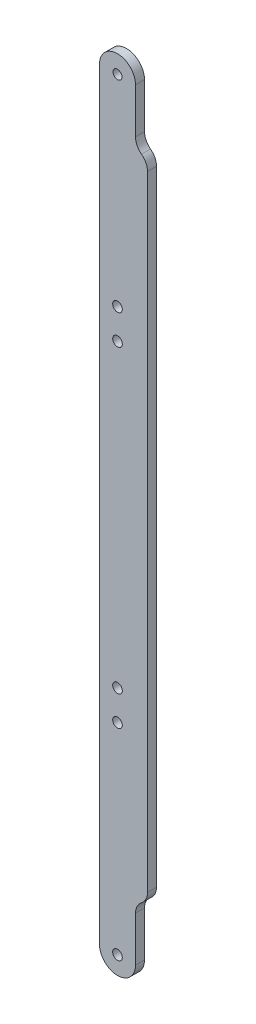
from build123d import *

# Parameters (mm, degrees)
SKETCH_2_W               = 18
SKETCH_2_H               = 90
SKETCH_2_R               = 1.6
EXTRUDE_1_DEPTH          = 3
SKETCH_3_R               = 1.5
SKETCH_3_W               = 18
SKETCH_3_H               = 45
EXTRUDE_2_DEPTH          = 3
SKETCH_4_R               = 1.6
CUT_EXTRUDE_1_DEPTH      = 3
CUT_EXTRUDE_2_DEPTH      = 139.102072216
CUT_EXTRUDE_2_DEPTH_BACK = 3


with BuildPart() as part:
    # 草图2 → 凸台-拉伸1 (new body)
    with BuildSketch(Plane.XY):
        with Locations((-9, -88.108866795)):
            Rectangle(SKETCH_2_W, SKETCH_2_H)
        with Locations((-10, -125.108866795)):
            Circle(SKETCH_2_R, mode=Mode.SUBTRACT)
    extrude(amount=EXTRUDE_1_DEPTH)

    # 草图3 → 凸台-拉伸2 (add)
    # profile 1 of 2: a face of its own
    with BuildSketch(Plane.XY.offset(3)):
        Polygon((-18, 1.891133205), (0, 1.891133205), (0, 46.891133205), (0, 136.891133205), (-18, 136.891133205), (-18, 46.891133205), align=None)
        with Locations((-10, 128.891133205)):
            Circle(SKETCH_3_R, mode=Mode.SUBTRACT)
    # profile 2 of 2: a face of its own
    with BuildSketch(Plane.XY.offset(3)):
        with Locations((-9, -20.608866795)):
            Rectangle(SKETCH_3_W, SKETCH_3_H)
    extrude(amount=-EXTRUDE_2_DEPTH)

    # 草图4 → 切除-拉伸1 (cut)
    with BuildSketch(Plane.XY.offset(3)):
        with Locations((-10, -58.108866795)):
            Circle(SKETCH_4_R)
        with Locations((-10, -48.108866795)):
            Circle(SKETCH_4_R)
        with Locations((-10, 51.891133205)):
            Circle(SKETCH_4_R)
        with Locations((-10, 61.891133205)):
            Circle(SKETCH_4_R)
    extrude(amount=-CUT_EXTRUDE_1_DEPTH, mode=Mode.SUBTRACT)

    # 草图5 → 切除-拉伸2 (cut, two sides: drawn at the far end of the back side and taken through both)
    with BuildSketch(Plane.XY.offset(3).offset(-CUT_EXTRUDE_2_DEPTH_BACK)):
        with BuildLine():
            Line((-4, -110.108866795), (-4, -125.108866795))
            ThreePointArc((-4, -125.108866795), (-10, -131.108866795), (-16, -125.108866795))
            Line((-16, -125.108866795), (-16, 128.891133205))
            ThreePointArc((-16, 128.891133205), (-10, 134.891133205), (-4, 128.891133205))
            Line((-4, 128.891133205), (-4, 113.891133205))
            ThreePointArc((-4, 113.891133205), (-3.472135955, 111.655065228), (-2, 109.891133205))
            ThreePointArc((-2, 109.891133205), (-0.527864045, 108.127201183), (0, 105.891133205))
            Line((0, 105.891133205), (0, 136.891133205))
            Line((0, 136.891133205), (-18, 136.891133205))
            Line((-18, 136.891133205), (-18, -133.108866795))
            Line((-18, -133.108866795), (0, -133.108866795))
            Line((0, -133.108866795), (0, -102.108866795))
            ThreePointArc((0, -102.108866795), (-0.527864045, -104.344934772), (-2, -106.108866795))
            ThreePointArc((-2, -106.108866795), (-3.472135955, -107.872798817), (-4, -110.108866795))
        make_face()
    extrude(amount=CUT_EXTRUDE_2_DEPTH + CUT_EXTRUDE_2_DEPTH_BACK, mode=Mode.SUBTRACT)


solid = part.part
